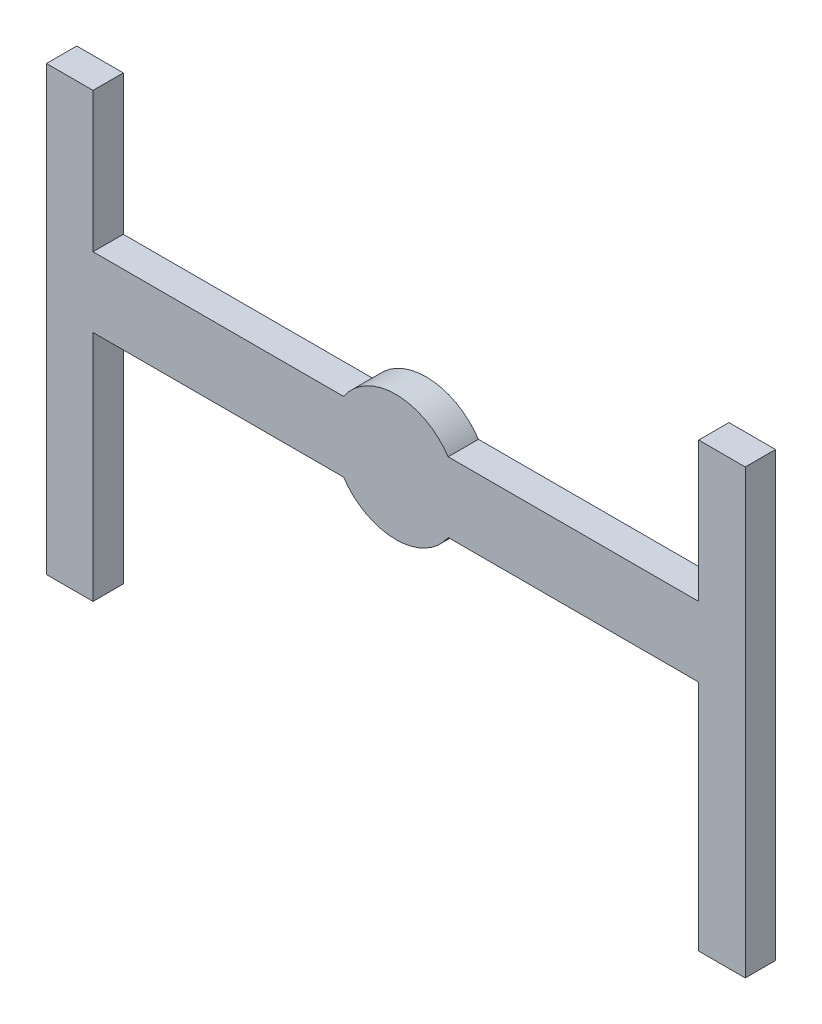
from build123d import *

# Parameters (mm, degrees)
ESQUISSE1_W             = 3000
ESQUISSE1_H             = 1900
BOSS_EXTRU_1_DEPTH      = 130
ENL_V_MAT_EXTRU_1_DEPTH = 130


with BuildPart() as part:
    # Esquisse1 → Boss.-Extru.1 (new body)
    with BuildSketch(Plane.XY):
        with Locations((1500, 950)):
            Rectangle(ESQUISSE1_W, ESQUISSE1_H)
    extrude(amount=-BOSS_EXTRU_1_DEPTH)

    # Esquisse4 → Enlèv. mat.-Extru.1 (cut)
    with BuildSketch(Plane.XY):
        with BuildLine():
            Line((200, 1300), (1275.500556794, 1300))
            ThreePointArc((1275.500556794, 1300), (1500, 1420), (1724.499443206, 1300))
            Line((1724.499443206, 1300), (2800, 1300))
            Line((2800, 1300), (2800, 1900))
            Line((2800, 1900), (200, 1900))
            Line((200, 1900), (200, 1300))
        make_face()
        with BuildLine():
            Line((200, 1000), (200, 0))
            Line((200, 0), (2800, 0))
            Line((2800, 0), (2800, 1000))
            Line((2800, 1000), (1724.499443206, 1000))
            ThreePointArc((1724.499443206, 1000), (1500, 880), (1275.500556794, 1000))
            Line((1275.500556794, 1000), (200, 1000))
        make_face()
    extrude(amount=-ENL_V_MAT_EXTRU_1_DEPTH, mode=Mode.SUBTRACT)


solid = part.part
